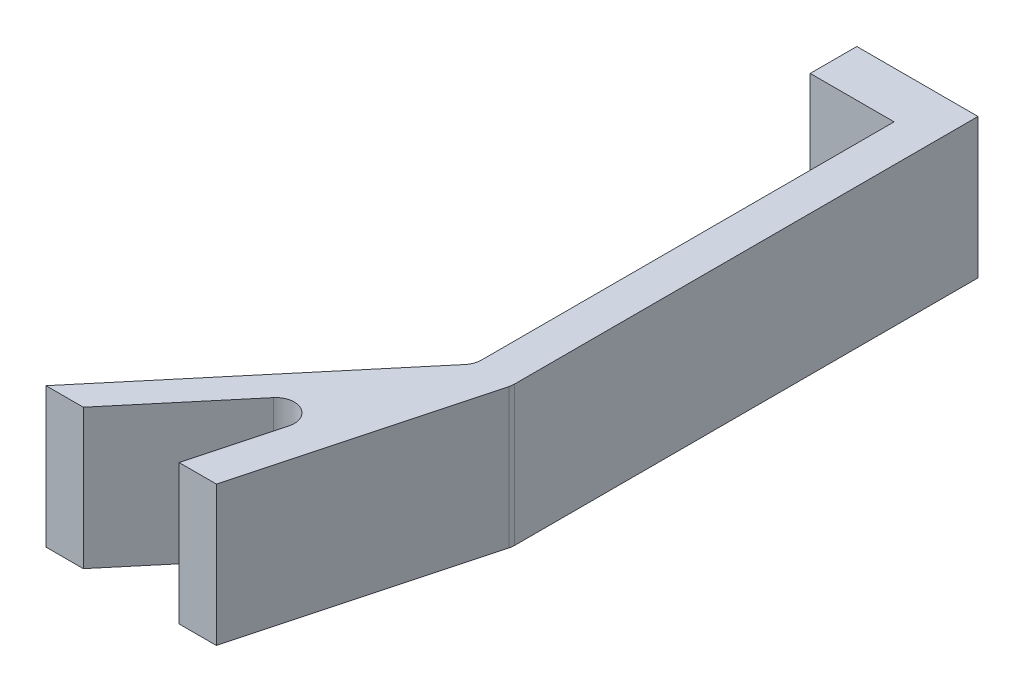
from build123d import *

# Parameters (mm, degrees)
BOSS_EXTRUDE1_DEPTH = 15
SKETCH3_R           = 1.5
CUT_EXTRUDE2_DEPTH  = 10


with BuildPart() as part:
    # Sketch1 → Boss-Extrude1 (new body)
    with BuildSketch(Plane(origin=(0, 0, 0), x_dir=(1, 0, 0), z_dir=(0, 1, 0))):
        with BuildLine():
            Line((-2, 0.727940469), (-2, 30))
            Line((-2, 30), (-2, 45))
            Line((-2, 45), (-11, 45))
            Line((-11, 45), (-11, 50))
            Line((-11, 50), (2, 50))
            Line((2, 50), (2, 30))
            Line((2, 30), (2, 0.263304995))
            ThreePointArc((2, 0.263304995), (1.982889723, 0.002252611), (1.931851653, -0.254333095))
            Line((1.931851653, -0.254333095), (-4.698729811, -25))
            Line((-4.698729811, -25), (-8.698729811, -25))
            Line((-8.698729811, -25), (-6.211472263, -15.717428462))
            ThreePointArc((-6.211472263, -15.717428462), (-7.219826689, -13.425768705), (-9.675412802, -13.914215152))
            Line((-9.675412802, -13.914215152), (-18.977490779, -25))
            Line((-18.977490779, -25), (-22.977490779, -25))
            Line((-22.977490779, -25), (-2.467911114, -0.557634751))
            ThreePointArc((-2.467911114, -0.557634751), (-2.120614758, 0.043900182), (-2, 0.727940469))
        make_face()
    extrude(amount=BOSS_EXTRUDE1_DEPTH)

    # Sketch3 → Cut-Extrude2 (cut)
    with BuildSketch(Plane(origin=(0, 0, -50), x_dir=(-1, 0, 0), z_dir=(0, 0, -1))):
        with Locations((4.5, 7.5)):
            Circle(SKETCH3_R)
    extrude(amount=-CUT_EXTRUDE2_DEPTH, mode=Mode.SUBTRACT)


solid = part.part
